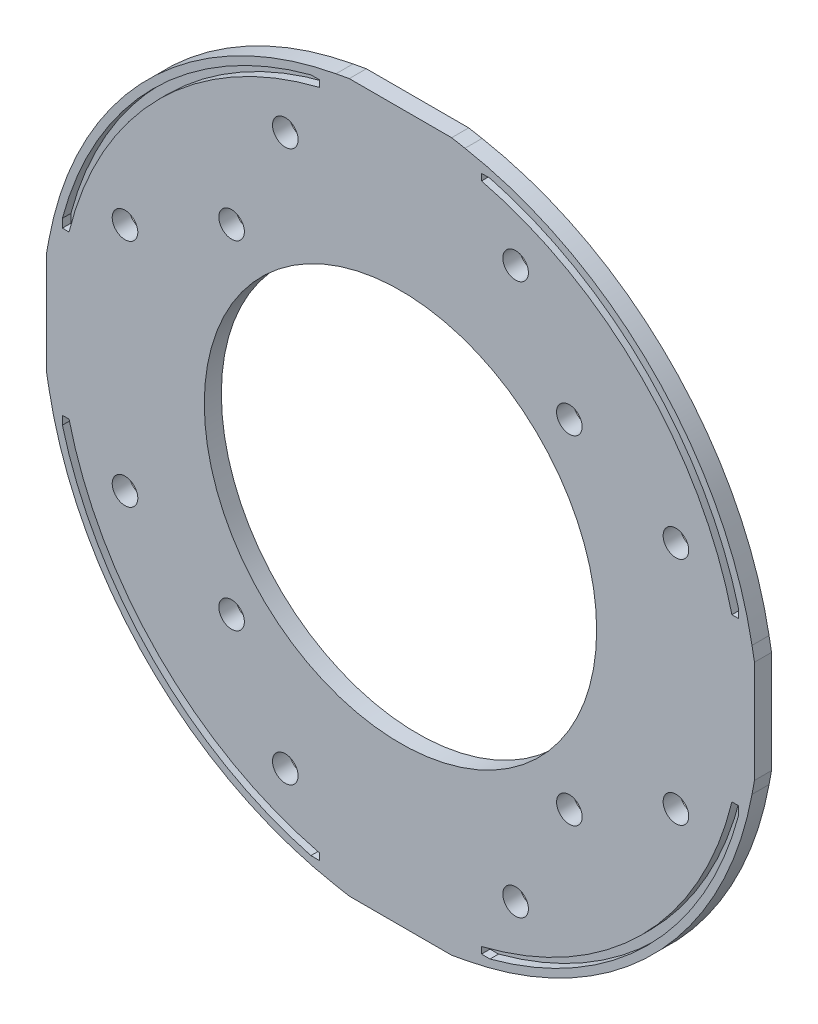
from build123d import *

# Parameters (mm, degrees)
EXTRUDE_1_DEPTH       = 2
CUT_EXTRUDE_1_DEPTH   = 1
CUT_EXTRUDE_2_DEPTH   = 1
CUT_EXTRUDE_3_DEPTH   = 1
CUT_EXTRUDE_4_DEPTH   = 1
HOLE_WIZARD_3_0_3_1_D = 3
HOLE_WIZARD_M421_D    = 46
FILLET_1_R            = 42


with BuildPart() as part:
    # Эскиз1 → Бобышка-Вытянуть1 (new body)
    with BuildSketch(Plane.XY.offset(-2)):
        Polygon((41.5, 6), (35.95120701, 35.95120701), (6, 41.5), (-6, 41.5), (-35.95120701, 35.95120701), (-41.5, 6), (-41.5, -6), (-35.95120701, -35.95120701), (-6, -41.5), (6, -41.5), (35.95120701, -35.95120701), (41.5, -6), align=None)
    extrude(amount=-EXTRUDE_1_DEPTH)

    # Эскиз2 → Вырез-Вытянуть1 (cut)
    with BuildSketch(Plane.XY.offset(-2)):
        with BuildLine():
            Line((9.5, -39.632688529), (10.5, -39.632688529))
            ThreePointArc((10.5, -39.632688529), (28.991378029, -28.991378029), (39.632688529, -10.5))
            Line((39.632688529, -10.5), (39.632688529, -9.5))
            Line((39.632688529, -9.5), (38.855501541, -9.5))
            ThreePointArc((38.855501541, -9.5), (28.284271247, -28.284271247), (9.5, -38.855501541))
            Line((9.5, -38.855501541), (9.5, -39.632688529))
        make_face()
    extrude(amount=-CUT_EXTRUDE_1_DEPTH, mode=Mode.SUBTRACT)

    # Эскиз3 → Вырез-Вытянуть2 (cut)
    with BuildSketch(Plane.XY.offset(-2)):
        with BuildLine():
            Line((-39.632688529, -9.5), (-39.632688529, -10.5))
            ThreePointArc((-39.632688529, -10.5), (-28.991378029, -28.991378029), (-10.5, -39.632688529))
            Line((-10.5, -39.632688529), (-9.5, -39.632688529))
            Line((-9.5, -39.632688529), (-9.5, -38.855501541))
            ThreePointArc((-9.5, -38.855501541), (-28.284271247, -28.284271247), (-38.855501541, -9.5))
            Line((-38.855501541, -9.5), (-39.632688529, -9.5))
        make_face()
    extrude(amount=-CUT_EXTRUDE_2_DEPTH, mode=Mode.SUBTRACT)

    # Эскиз4 → Вырез-Вытянуть3 (cut)
    with BuildSketch(Plane.XY.offset(-2)):
        with BuildLine():
            Line((39.632688529, 9.5), (39.632688529, 10.5))
            ThreePointArc((39.632688529, 10.5), (28.991378029, 28.991378029), (10.5, 39.632688529))
            Line((10.5, 39.632688529), (9.5, 39.632688529))
            Line((9.5, 39.632688529), (9.5, 38.855501541))
            ThreePointArc((9.5, 38.855501541), (28.284271247, 28.284271247), (38.855501541, 9.5))
            Line((38.855501541, 9.5), (39.632688529, 9.5))
        make_face()
    extrude(amount=-CUT_EXTRUDE_3_DEPTH, mode=Mode.SUBTRACT)

    # Эскиз5 → Вырез-Вытянуть4 (cut)
    with BuildSketch(Plane.XY.offset(-2)):
        with BuildLine():
            Line((-9.5, 39.632688529), (-10.5, 39.632688529))
            ThreePointArc((-10.5, 39.632688529), (-28.991378029, 28.991378029), (-39.632688529, 10.5))
            Line((-39.632688529, 10.5), (-39.632688529, 9.5))
            Line((-39.632688529, 9.5), (-38.855501541, 9.5))
            ThreePointArc((-38.855501541, 9.5), (-28.284271247, 28.284271247), (-9.5, 38.855501541))
            Line((-9.5, 38.855501541), (-9.5, 39.632688529))
        make_face()
    extrude(amount=-CUT_EXTRUDE_4_DEPTH, mode=Mode.SUBTRACT)

    # Диаметр отверстия Ø3.0 (3)1 (through all)
    with Locations(Plane.XY.offset(-2)):
        with Locations((32.291639785, -13.5), (32.291639785, 13.5), (19.798989873, 19.798989873), (19.798989873, -19.798989873), (13.5, -32.291639785), (-13.5, -32.291639785), (-19.798989873, -19.798989873), (-19.798989873, 19.798989873), (-13.5, 32.291639785), (13.5, 32.291639785), (-32.291639785, 13.5), (-32.291639785, -13.5)):
            Hole(HOLE_WIZARD_3_0_3_1_D / 2)

    # Отверстие с зазором M421 (through all)
    with Locations(Plane.XY.offset(-2)):
        with Locations((0, 0)):
            Hole(HOLE_WIZARD_M421_D / 2)

    # Скругление1
    fillet_1_edges = [part.edges().sort_by_distance(p)[0] for p in [
        (35.95120701, -35.95120701, -3),
        (-35.95120701, -35.95120701, -3),
        (-35.95120701, 35.95120701, -3),
        (35.95120701, 35.95120701, -3),
    ]]
    fillet(fillet_1_edges, radius=FILLET_1_R)


solid = part.part
